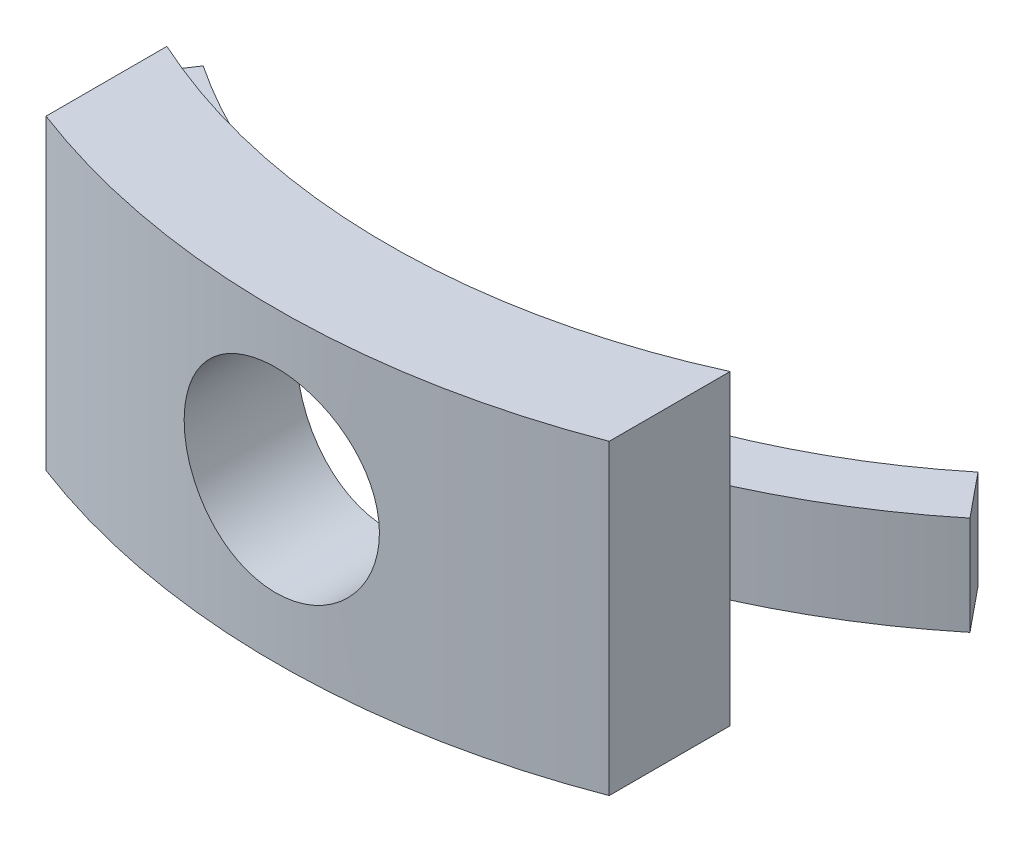
from build123d import *
from build123d.topology import SkipClean

# Parameters (mm, degrees)
SKETCH1_R           = 79.871147442
SKETCH1_R_2         = 68.595086453
BOSS_EXTRUDE1_DEPTH = 31
SKETCH2_W           = 233.196890583
SKETCH2_H           = 222.59703192
SKETCH2_W_2         = 56.896718534
SKETCH2_H_2         = 45.723887068
CUT_EXTRUDE1_DEPTH  = 31
BOSS_EXTRUDE2_DEPTH = 5
CUT_EXTRUDE3_DEPTH  = 18
SKETCH6_R           = 9.86264383
CUT_EXTRUDE4_DEPTH  = 128


with BuildPart() as part:
    # Sketch1 → Boss-Extrude1 (new body)
    with BuildSketch(Plane(origin=(0, 0, 0), x_dir=(1, 0, 0), z_dir=(0, 1, 0))):
        with Locations(Location((0, 0, 0), (0, 0, 270))):
            Circle(SKETCH1_R)
        with Locations(Location((0, 0, 0), (0, 0, 270))):
            Circle(SKETCH1_R_2, mode=Mode.SUBTRACT)
    extrude(amount=BOSS_EXTRUDE1_DEPTH)

    # Sketch2 → Cut-Extrude1 (cut)
    with BuildSketch(Plane(origin=(0, 31, 0), x_dir=(1, 0, 0), z_dir=(0, 1, 0))):
        with Locations((-10.138995242, -14.747629444)):
            Rectangle(SKETCH2_W, SKETCH2_H)
        with Locations((0, -68.595086453)):
            Rectangle(SKETCH2_W_2, SKETCH2_H_2, mode=Mode.SUBTRACT)
    extrude(amount=-CUT_EXTRUDE1_DEPTH, mode=Mode.SUBTRACT)

    # Sketch4 → Boss-Extrude2 (add, symmetric)
    with BuildSketch(Plane(origin=(0, 16, 0), x_dir=(1, 0, 0), z_dir=(0, 1, 0))):
        with BuildLine():
            Line((43.392343097, -53.126174774), (39.773823752, -48.69594406))
            ThreePointArc((39.773823752, -48.69594406), (3.024910809, -62.802085461), (-34.909607277, -52.293129027))
            Line((-34.909607277, -52.293129027), (-38.085592821, -57.050622301))
            ThreePointArc((-38.085592821, -57.050622301), (3.30010935, -68.51565634), (43.392343097, -53.126174774))
        make_face()
    extrude(amount=BOSS_EXTRUDE2_DEPTH, both=True)

    # Sketch5 → Cut-Extrude3 (cut)
    with SkipClean():  # the faces are left unmerged after this step: merging them gives an invalid solid
        with BuildSketch(Plane(origin=(0, 21, 0), x_dir=(1, 0, 0), z_dir=(0, 1, 0))):
            with BuildLine():
                ThreePointArc((-20.365734208, -65.502082071), (0, -68.595086453), (20.365734208, -65.502082071))
                Line((20.365734208, -65.502082071), (20.365734208, -59.485198948))
                ThreePointArc((20.365734208, -59.485198948), (0, -62.874891839), (-20.365734208, -59.485198948))
                Line((-20.365734208, -59.485198948), (-20.365734208, -65.502082071))
            make_face()
        extrude(amount=-CUT_EXTRUDE3_DEPTH, mode=Mode.SUBTRACT)

    # Sketch6 → Cut-Extrude4 (cut)
    with SkipClean():  # the faces are left unmerged after this step: merging them gives an invalid solid
        with BuildSketch(Plane.XY):
            with Locations(Location((0, 16, 0), (0, 0, 180))):
                Circle(SKETCH6_R)
        extrude(amount=CUT_EXTRUDE4_DEPTH, mode=Mode.SUBTRACT)


solid = part.part
